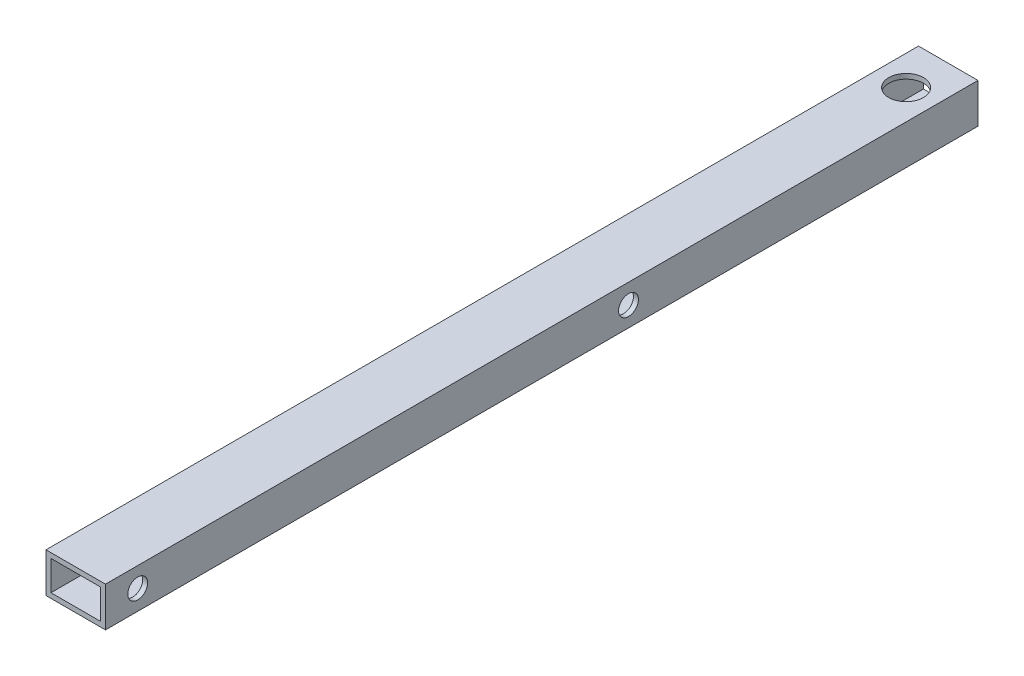
from build123d import *

# Parameters (mm, degrees)
SKETCH1_W           = 38.1
SKETCH1_H           = 25.4
SKETCH1_W_2         = 31.75
SKETCH1_H_2         = 19.05
BOSS_EXTRUDE1_DEPTH = 558.8
CUT_EXTRUDE1_REACH  = 561.701
SKETCH2_R           = 11.1125
SKETCH3_R           = 3.175
CUT_EXTRUDE2_DEPTH  = 3.175
SKETCH4_R           = 6.35
CUT_EXTRUDE3_DEPTH  = 3.175


with BuildPart() as part:
    # Sketch1 → Boss-Extrude1 (new body)
    with BuildSketch(Plane.XY):
        Rectangle(SKETCH1_W, SKETCH1_H)
        Rectangle(SKETCH1_W_2, SKETCH1_H_2, mode=Mode.SUBTRACT)
    extrude(amount=BOSS_EXTRUDE1_DEPTH)

    # Cut-Extrude1: up to this face of the body (flat: up to its plane)
    cut_extrude1_end = Plane(part.part.faces().sort_by_distance((0, -12.7, 279.4))[0])
    # Sketch2 → Cut-Extrude1 (cut, up to the picked face)
    with BuildSketch(Plane(origin=(0, 12.7, 0), x_dir=(1, 0, 0), z_dir=(0, 1, 0)), mode=Mode.PRIVATE) as cut_extrude1_sk1:
        with Locations(Location((0, -26.9875, 0), (0, 0, 270))):
            Circle(SKETCH2_R)
    cut_extrude1_tool1 = split(extrude(cut_extrude1_sk1.sketch, amount=-CUT_EXTRUDE1_REACH, mode=Mode.PRIVATE), bisect_by=cut_extrude1_end, keep=Keep.BOTH, mode=Mode.PRIVATE)
    add(cut_extrude1_tool1.solids().sort_by(Axis((0, 12.7, 26.9875), (0, -1, 0)))[0], mode=Mode.SUBTRACT)

    # Sketch3 → Cut-Extrude2 (cut)
    with BuildSketch(Plane.ZY.offset(19.05)):
        with Locations((538.1625, 0)):
            Circle(SKETCH3_R)
        with Locations((223.8375, 0)):
            Circle(SKETCH3_R)
    extrude(amount=-CUT_EXTRUDE2_DEPTH, mode=Mode.SUBTRACT)

    # Sketch4 → Cut-Extrude3 (cut)
    with BuildSketch(Plane(origin=(19.05, 0, 0), x_dir=(0, 0, -1), z_dir=(1, 0, 0))):
        with Locations((-538.1625, 0)):
            Circle(SKETCH4_R)
        with Locations((-223.8375, 0)):
            Circle(SKETCH4_R)
    extrude(amount=-CUT_EXTRUDE3_DEPTH, mode=Mode.SUBTRACT)


solid = part.part
